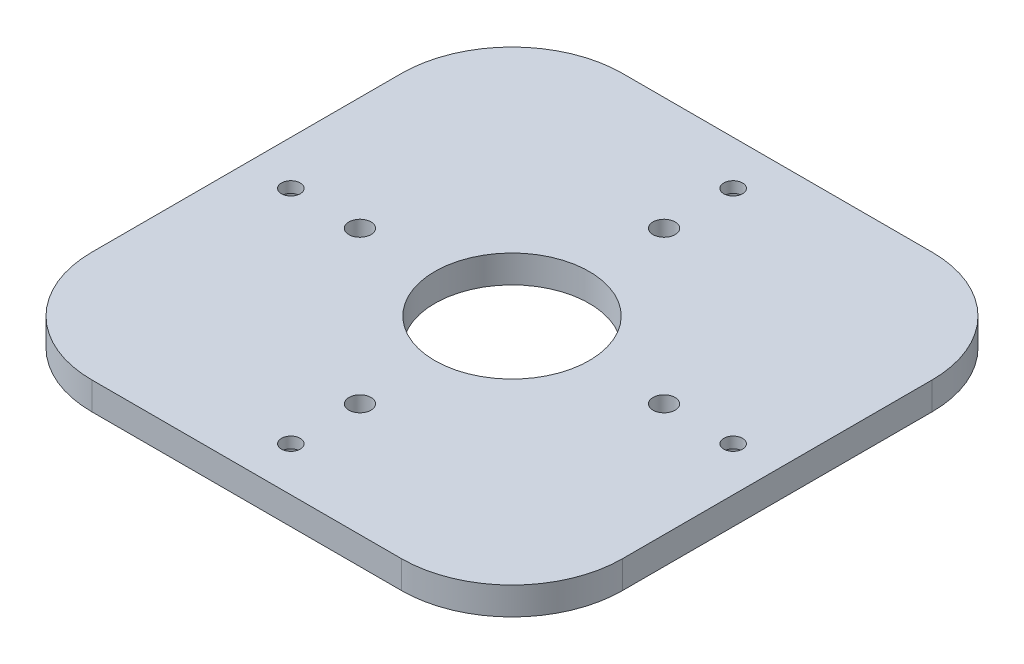
from build123d import *

# Parameters (mm, degrees)
SKETCH1_W                     = 96
SKETCH1_H                     = 96
SKETCH1_R                     = 13.97
BOSS_EXTRUDE1_DEPTH           = 5
FILLET1_R                     = 20
CBORE_FOR_M3_SHCS1_AT_2_COUNT = 2
CBORE_FOR_M3_SHCS1_AT_2_PITCH = 56.568542495
CBORE_FOR_M3_SHCS1_AT_3_COUNT = 2
CBORE_FOR_M3_SHCS1_AT_3_PITCH = 80
CBORE_FOR_M3_SHCS1_AT_4_COUNT = 2
CBORE_FOR_M3_SHCS1_AT_4_PITCH = 56.568542495
SKETCH7_R                     = 2
CUT_EXTRUDE1_DEPTH            = 69.066144301


with BuildPart() as part:
    # Sketch1 → Boss-Extrude1 (new body)
    with BuildSketch(Plane(origin=(0, 0, 0), x_dir=(1, 0, 0), z_dir=(0, 1, 0))):
        Rectangle(SKETCH1_W, SKETCH1_H)
        with Locations(Location((0, 0, 0), (0, 0, 270))):
            Circle(SKETCH1_R, mode=Mode.SUBTRACT)
    extrude(amount=BOSS_EXTRUDE1_DEPTH)

    # Fillet1
    fillet1_edges = [part.edges().sort_by_distance(p)[0] for p in [
        (-48, 2.5, -48),
        (48, 2.5, -48),
        (48, 2.5, 48),
        (-48, 2.5, 48),
    ]]
    fillet(fillet1_edges, radius=FILLET1_R)

    # Sketch6 → CBORE for M3 SHCS1 (revolve, cut)
    with BuildSketch(Plane(origin=(-40, 0, 0), x_dir=(0, 0, -1), z_dir=(1, 0, 0))):
        Polygon((0, 0), (0, 5), (1.7, 5), (1.7, 3), (3.25, 3), (3.25, 0.025), (3.275, 0), align=None)
    cbore_for_m3_shcs1 = revolve(axis=Axis((-40, -6.35, 0), (0, 1, 0)), mode=Mode.SUBTRACT)

    # CBORE for M3 SHCS1 at 2: CBORE for M3 SHCS1 ×2
    with Locations(*[Vector(0.7071067811865476, 0, 0.7071067811865476) * (i * CBORE_FOR_M3_SHCS1_AT_2_PITCH) for i in range(1, CBORE_FOR_M3_SHCS1_AT_2_COUNT)]):
        add(cbore_for_m3_shcs1, mode=Mode.SUBTRACT)

    # CBORE for M3 SHCS1 at 3: CBORE for M3 SHCS1 ×2
    with Locations(*[(i * CBORE_FOR_M3_SHCS1_AT_3_PITCH, 0, 0) for i in range(1, CBORE_FOR_M3_SHCS1_AT_3_COUNT)]):
        add(cbore_for_m3_shcs1, mode=Mode.SUBTRACT)

    # CBORE for M3 SHCS1 at 4: CBORE for M3 SHCS1 ×2
    with Locations(*[Vector(0.7071067811865476, 0, -0.7071067811865476) * (i * CBORE_FOR_M3_SHCS1_AT_4_PITCH) for i in range(1, CBORE_FOR_M3_SHCS1_AT_4_COUNT)]):
        add(cbore_for_m3_shcs1, mode=Mode.SUBTRACT)

    # Sketch7 → Cut-Extrude1 (cut, through all)
    with BuildSketch(Plane.XZ):
        with Locations(Location((-27.5, 0, 0), (0, 0, 270))):
            Circle(SKETCH7_R)
        with Locations(Location((0, 27.5, 0), (0, 0, 270))):
            Circle(SKETCH7_R)
        with Locations(Location((27.5, 0, 0), (0, 0, 270))):
            Circle(SKETCH7_R)
        with Locations(Location((0, -27.5, 0), (0, 0, 270))):
            Circle(SKETCH7_R)
    extrude(amount=-CUT_EXTRUDE1_DEPTH, mode=Mode.SUBTRACT)


solid = part.part
